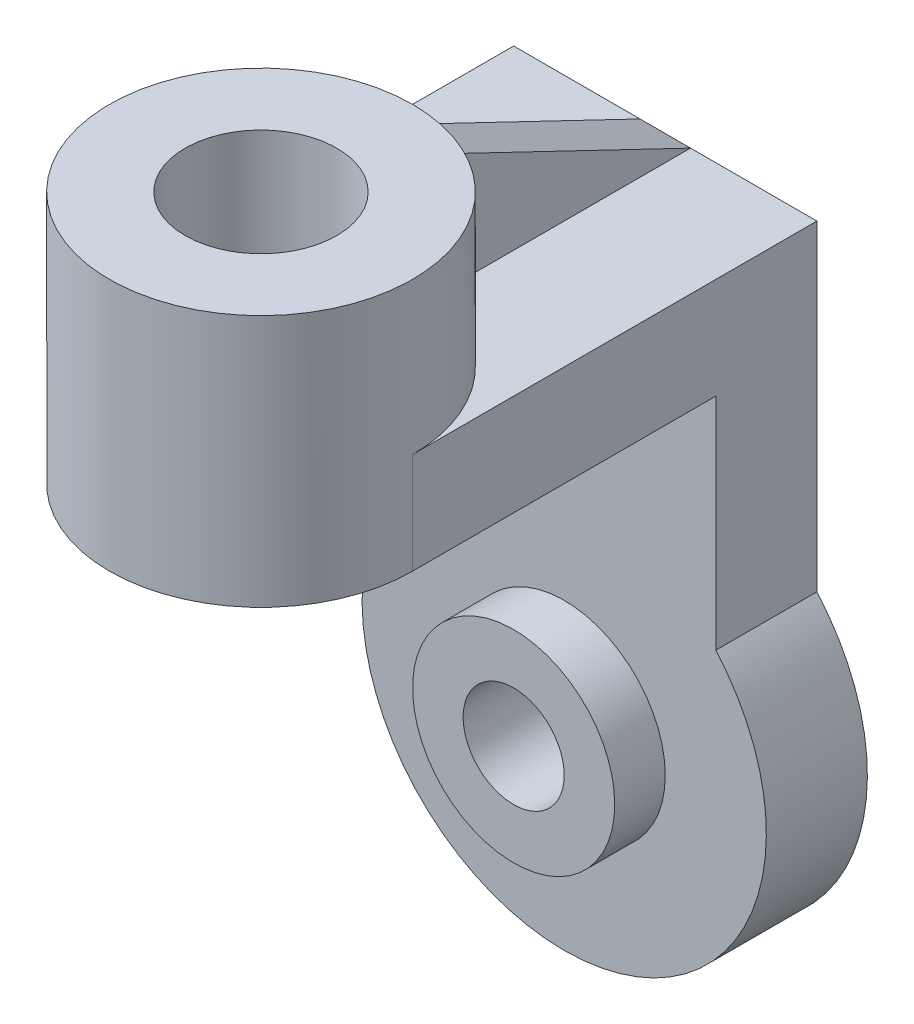
from build123d import *

# Parameters (mm, degrees)
EXTRUDE_1_DEPTH     = 5
SKETCH_2_R          = 10
EXTRUDE_2_DEPTH     = 10
SKETCH_3_R          = 5
CUT_EXTRUDE_1_DEPTH = 20
SKETCH_4_W          = 30
SKETCH_4_H          = 40
EXTRUDE_3_DEPTH     = 10
SKETCH_5_R          = 15
EXTRUDE_4_DEPTH     = 25
SKETCH_6_R          = 7.5
CUT_EXTRUDE_2_DEPTH = 25
RIB_3_REACH         = 82.623
SKETCH_7_WALL_W     = 190.976004214
SKETCH_7_WALL_H     = 5


with BuildPart() as part:
    # 草图1 → 凸台-拉伸1 (new, symmetric)
    with BuildSketch(Plane.XY):
        with BuildLine():
            Line((-15, 35), (15, 35))
            Line((15, 35), (15, 13.228756555))
            ThreePointArc((15, 13.228756555), (0, -20), (-15, 13.228756555))
            Line((-15, 13.228756555), (-15, 35))
        make_face()
    extrude(amount=EXTRUDE_1_DEPTH, both=True)

    # 草图2 → 凸台-拉伸2 (add, symmetric)
    with BuildSketch(Plane.XY):
        Circle(SKETCH_2_R)
    extrude(amount=EXTRUDE_2_DEPTH, both=True)

    # 草图3 → 切除-拉伸1 (cut)
    with BuildSketch(Plane.XY.offset(10)):
        Circle(SKETCH_3_R)
    extrude(amount=-CUT_EXTRUDE_1_DEPTH, mode=Mode.SUBTRACT)

    # 草图4 → 凸台-拉伸3 (add)
    with BuildSketch(Plane(origin=(0, 35, 0), x_dir=(1, 0, 0), z_dir=(0, 1, 0))):
        with Locations((0, -15)):
            Rectangle(SKETCH_4_W, SKETCH_4_H)
    extrude(amount=EXTRUDE_3_DEPTH)

    # 草图5 → 凸台-拉伸4 (add)
    with BuildSketch(Plane.XZ.offset(-35)):
        with Locations(Location((0, 35, 0), (0, 0, 270))):
            Circle(SKETCH_5_R)
    extrude(amount=-EXTRUDE_4_DEPTH)

    # 草图6 → 切除-拉伸2 (cut)
    with BuildSketch(Plane(origin=(0, 60, 0), x_dir=(1, 0, 0), z_dir=(0, 1, 0))):
        with Locations(Location((0, -35, 0), (0, 0, 270))):
            Circle(SKETCH_6_R)
    extrude(amount=-CUT_EXTRUDE_2_DEPTH, mode=Mode.SUBTRACT)

    # 草图7 wall → 筋3 (add, up to next)
    with BuildSketch(Plane(origin=(0, 51, 7.5), x_dir=(0, 0.432731067585, 0.901523057468), z_dir=(0, -0.901523057468, 0.432731067585)), mode=Mode.PRIVATE) as rib_3_sk1:
        Rectangle(SKETCH_7_WALL_W, SKETCH_7_WALL_H)
    rib_3_tool1 = extrude(rib_3_sk1.sketch, amount=RIB_3_REACH, mode=Mode.PRIVATE) - part.part
    add(rib_3_tool1.solids().sort_by_distance((0, 51, 7.5))[0])


solid = part.part
